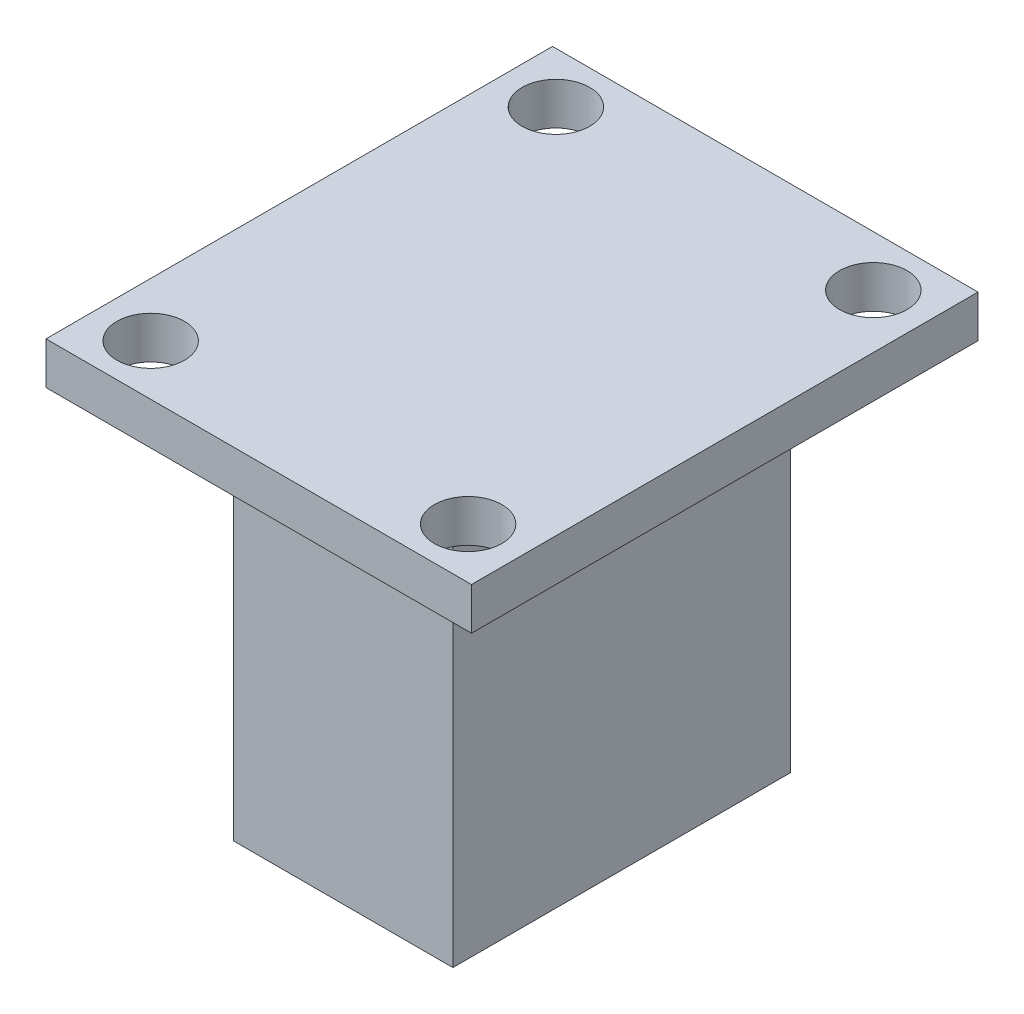
from build123d import *

# Parameters (mm, degrees)
SKETCH3_W           = 32.004
SKETCH3_H           = 38.1
BOSS_EXTRUDE1_DEPTH = 3.175
SKETCH4_R           = 2.54
SCREW_HOLES_DEPTH   = 26.080811969
SKETCH5_W           = 16.51
SKETCH5_H           = 25.4
WHEEL_APPROX_DEPTH  = 32.004


with BuildPart() as part:
    # Sketch3 → Boss-Extrude1 (new body)
    with BuildSketch(Plane(origin=(0, 0, 0), x_dir=(1, 0, 0), z_dir=(0, 1, 0))):
        Rectangle(SKETCH3_W, SKETCH3_H)
    extrude(amount=-BOSS_EXTRUDE1_DEPTH)

    # Sketch4 → Screw Holes (cut, through all)
    with BuildSketch(Plane(origin=(0, 0, 0), x_dir=(1, 0, 0), z_dir=(0, 1, 0))):
        with Locations(Location((11.938, 15.24, 0), (0, 0, 270))):
            Circle(SKETCH4_R)
        with Locations(Location((-11.938, 15.24, 0), (0, 0, 270))):
            Circle(SKETCH4_R)
        with Locations(Location((-11.938, -15.24, 0), (0, 0, 270))):
            Circle(SKETCH4_R)
        with Locations(Location((11.938, -15.24, 0), (0, 0, 270))):
            Circle(SKETCH4_R)
    extrude(amount=-SCREW_HOLES_DEPTH, mode=Mode.SUBTRACT)

    # Sketch5 → Wheel Approx (add)
    with BuildSketch(Plane(origin=(0, 0, 0), x_dir=(1, 0, 0), z_dir=(0, 1, 0))):
        Rectangle(SKETCH5_W, SKETCH5_H)
    extrude(amount=-WHEEL_APPROX_DEPTH)


solid = part.part
